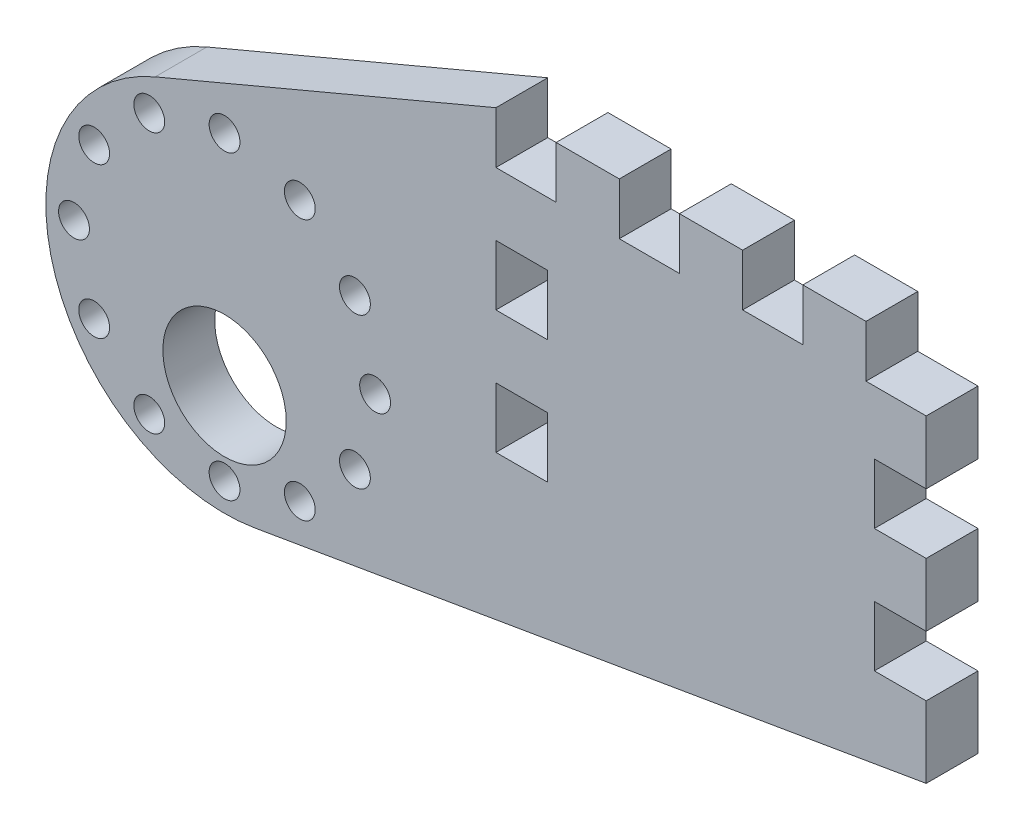
from build123d import *

# Parameters (mm, degrees)
BOSS_EXTRUDE1_DEPTH          = 5.334
SKETCH1_3_R                  = 6.35
CUT_EXTRUDE2_DEPTH           = 80.087198141
F_1_8_0_125_DIAMETER_HOLE1_D = 3.175
SKETCH4_W                    = 6.1976
SKETCH4_H                    = 5.334
CUT_EXTRUDE3_DEPTH           = 80.087198141
LPATTERN1_COUNT              = 4
LPATTERN1_PITCH              = 12.7
SKETCH5_W                    = 5.334
SKETCH5_H                    = 6.1976
CUT_EXTRUDE4_DEPTH           = 80.087198141
LPATTERN2_COUNT              = 2
LPATTERN2_PITCH              = 12.7


with BuildPart() as part:
    # Sketch1 → Boss-Extrude1 (new body)
    with BuildSketch(Plane.XY):
        with BuildLine():
            Line((72.2376, 31.75), (27.94, 31.75))
            Line((27.94, 31.75), (-7.148981901, 16.95441116))
            ThreePointArc((-7.148981901, 16.95441116), (-17.663197211, -5.154751622), (3.092321188, -18.138289602))
            Line((3.092321188, -18.138289602), (72.2376, -6.35))
            Line((72.2376, -6.35), (72.2376, 31.75))
        make_face()
    extrude(amount=BOSS_EXTRUDE1_DEPTH)

    # Sketch1<3> → Cut-Extrude2 (cut, through all)
    with BuildSketch(Plane.XY):
        with Locations((0, -7)):
            Circle(SKETCH1_3_R)
    extrude(amount=CUT_EXTRUDE2_DEPTH, mode=Mode.SUBTRACT)

    # 1/8 (0.125) Diameter Hole1 (through all)
    with Locations(Plane.XY.offset(5.334)):
        with Locations((0, 15.5), (7.75, 13.423393759), (13.423393759, 7.75), (15.5, 0), (13.423393759, -7.75), (7.75, -13.423393759), (0, -15.5), (-7.75, -13.423393759), (-13.423393759, -7.75), (-15.5, 0), (-13.423393759, 7.75), (-7.75, 13.423393759)):
            Hole(F_1_8_0_125_DIAMETER_HOLE1_D / 2)

    # Sketch4 → Cut-Extrude3 (cut, through all)
    with BuildSketch(Plane.XY.offset(5.334)):
        with Locations((31.0388, 29.083)):
            Rectangle(SKETCH4_W, SKETCH4_H)
    cut_extrude3 = extrude(amount=-CUT_EXTRUDE3_DEPTH, mode=Mode.SUBTRACT)

    # LPattern1: Cut-Extrude3 ×4
    with Locations(*[(i * LPATTERN1_PITCH, 0, 0) for i in range(1, LPATTERN1_COUNT)]):
        add(cut_extrude3, mode=Mode.SUBTRACT)

    # Sketch5 → Cut-Extrude4 (cut, through all)
    with BuildSketch(Plane.XY.offset(5.334)):
        with Locations((69.5706, 16.8148)):
            Rectangle(SKETCH5_W, SKETCH5_H)
        with Locations((30.607, 16.8148)):
            Rectangle(SKETCH5_W, SKETCH5_H)
    cut_extrude4 = extrude(amount=-CUT_EXTRUDE4_DEPTH, mode=Mode.SUBTRACT)

    # LPattern2: Cut-Extrude4 ×2
    with Locations(*[(0, -i * LPATTERN2_PITCH, 0) for i in range(1, LPATTERN2_COUNT)]):
        add(cut_extrude4, mode=Mode.SUBTRACT)


solid = part.part
